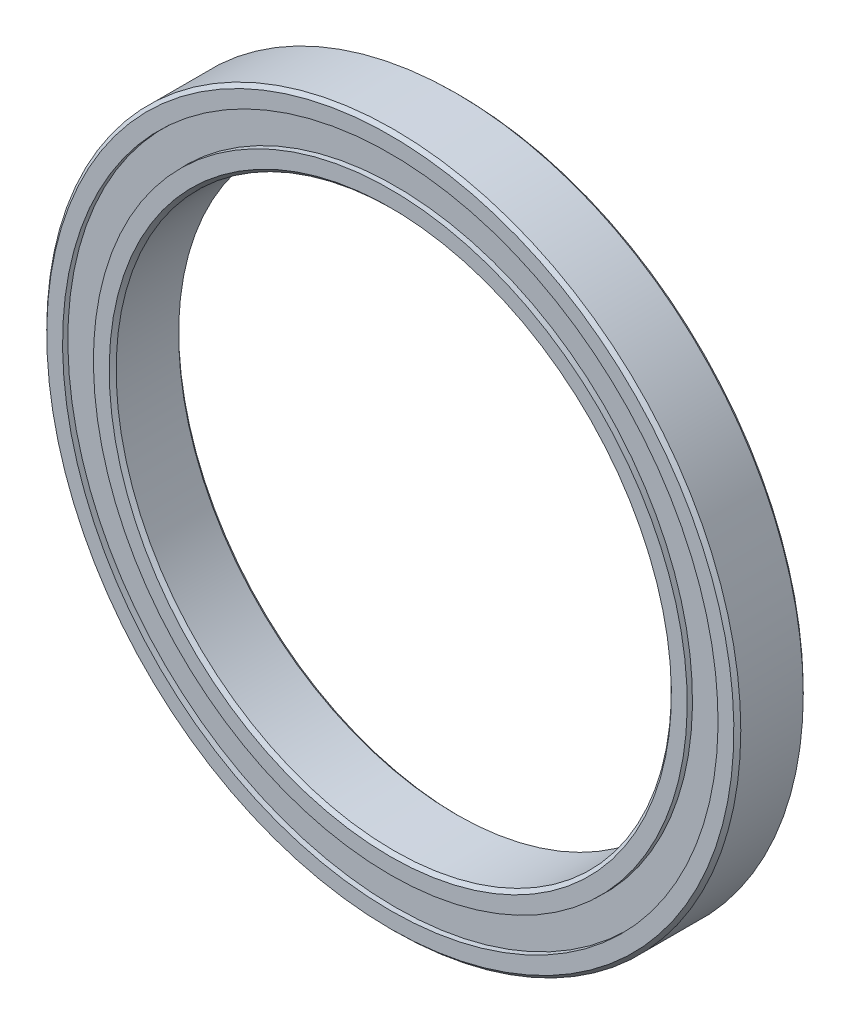
from build123d import *

# Parameters (mm, degrees)
SKETCH5_W         = 0.381
SKETCH5_H         = 4.393644444
CIRPATTERN1_COUNT = 27


with BuildPart() as part:
    # Sketch5 → Revolve1 (revolve)
    with BuildSketch(Plane(origin=(0, 0, 0), x_dir=(0, 0, -1), z_dir=(1, 0, 0)), mode=Mode.PRIVATE) as revolve1_sk:
        with BuildLine():
            Line((4.5, 50), (-4.5, 50))
            Line((-4.5, 50), (-5, 49.5))
            Line((-5, 49.5), (-5, 47.222222222))
            Line((-5, 47.222222222), (-2.222222222, 47.222222222))
            ThreePointArc((-2.222222222, 47.222222222), (0, 48.142696805), (2.222222222, 47.222222222))
            Line((2.222222222, 47.222222222), (5, 47.222222222))
            Line((5, 47.222222222), (5, 49.5))
            Line((5, 49.5), (4.5, 50))
        make_face()
        with Locations((4.071348403, 45)):
            Rectangle(SKETCH5_W, SKETCH5_H)
        with Locations((-4.071348403, 45)):
            Rectangle(SKETCH5_W, SKETCH5_H)
    revolve(revolve1_sk.sketch.rotate(Axis((0, 0, 5), (0, 0, -1)), 180), axis=Axis((0, 0, 5), (0, 0, -1)))


with BuildPart() as body_2:
    # Sketch3 → Revolve3 (revolve)
    with BuildSketch(Plane(origin=(0, 0, 0), x_dir=(0, 0, -1), z_dir=(1, 0, 0)), mode=Mode.PRIVATE) as revolve3_sk:
        with BuildLine():
            Line((-5, 42.777777778), (-2.222222222, 42.777777778))
            ThreePointArc((-2.222222222, 42.777777778), (0, 41.857303195), (2.222222222, 42.777777778))
            Line((2.222222222, 42.777777778), (5, 42.777777778))
            Line((5, 42.777777778), (5, 40.5))
            Line((5, 40.5), (4.5, 40))
            Line((4.5, 40), (-4.5, 40))
            Line((-4.5, 40), (-5, 40.5))
            Line((-5, 40.5), (-5, 42.777777778))
        make_face()
    revolve(revolve3_sk.sketch.rotate(Axis((0, 0, 5), (0, 0, -1)), 180), axis=Axis((0, 0, 5), (0, 0, -1)))


with BuildPart() as body_3:
    # Sketch4 → Revolve4 (revolve)
    with BuildSketch(Plane(origin=(0, 0, 0), x_dir=(0, 0, -1), z_dir=(1, 0, 0))):
        with BuildLine():
            Line((-3.142696805, 45), (3.142696805, 45))
            ThreePointArc((3.142696805, 45), (0, 48.142696805), (-3.142696805, 45))
        make_face()
    revolve(axis=Axis((0, 45, 3.142696805), (0, 0, -1)))


with BuildPart() as cirpattern1_1:
    # CirPattern1: pattern copy
    add(body_3.part.rotate(Axis((0, 0, 0), (0, 0, 1)), 1 * 360 / CIRPATTERN1_COUNT))


with BuildPart() as cirpattern1_2:
    # CirPattern1: pattern copy
    add(body_3.part.rotate(Axis((0, 0, 0), (0, 0, 1)), 2 * 360 / CIRPATTERN1_COUNT))


with BuildPart() as cirpattern1_3:
    # CirPattern1: pattern copy
    add(body_3.part.rotate(Axis((0, 0, 0), (0, 0, 1)), 3 * 360 / CIRPATTERN1_COUNT))


with BuildPart() as cirpattern1_4:
    # CirPattern1: pattern copy
    add(body_3.part.rotate(Axis((0, 0, 0), (0, 0, 1)), 4 * 360 / CIRPATTERN1_COUNT))


with BuildPart() as cirpattern1_5:
    # CirPattern1: pattern copy
    add(body_3.part.rotate(Axis((0, 0, 0), (0, 0, 1)), 5 * 360 / CIRPATTERN1_COUNT))


with BuildPart() as cirpattern1_6:
    # CirPattern1: pattern copy
    add(body_3.part.rotate(Axis((0, 0, 0), (0, 0, 1)), 6 * 360 / CIRPATTERN1_COUNT))


with BuildPart() as cirpattern1_7:
    # CirPattern1: pattern copy
    add(body_3.part.rotate(Axis((0, 0, 0), (0, 0, 1)), 7 * 360 / CIRPATTERN1_COUNT))


with BuildPart() as cirpattern1_8:
    # CirPattern1: pattern copy
    add(body_3.part.rotate(Axis((0, 0, 0), (0, 0, 1)), 8 * 360 / CIRPATTERN1_COUNT))


with BuildPart() as cirpattern1_9:
    # CirPattern1: pattern copy
    add(body_3.part.rotate(Axis((0, 0, 0), (0, 0, 1)), 9 * 360 / CIRPATTERN1_COUNT))


with BuildPart() as cirpattern1_10:
    # CirPattern1: pattern copy
    add(body_3.part.rotate(Axis((0, 0, 0), (0, 0, 1)), 10 * 360 / CIRPATTERN1_COUNT))


with BuildPart() as cirpattern1_11:
    # CirPattern1: pattern copy
    add(body_3.part.rotate(Axis((0, 0, 0), (0, 0, 1)), 11 * 360 / CIRPATTERN1_COUNT))


with BuildPart() as cirpattern1_12:
    # CirPattern1: pattern copy
    add(body_3.part.rotate(Axis((0, 0, 0), (0, 0, 1)), 12 * 360 / CIRPATTERN1_COUNT))


with BuildPart() as cirpattern1_13:
    # CirPattern1: pattern copy
    add(body_3.part.rotate(Axis((0, 0, 0), (0, 0, 1)), 13 * 360 / CIRPATTERN1_COUNT))


with BuildPart() as cirpattern1_14:
    # CirPattern1: pattern copy
    add(body_3.part.rotate(Axis((0, 0, 0), (0, 0, 1)), 14 * 360 / CIRPATTERN1_COUNT))


with BuildPart() as cirpattern1_15:
    # CirPattern1: pattern copy
    add(body_3.part.rotate(Axis((0, 0, 0), (0, 0, 1)), 15 * 360 / CIRPATTERN1_COUNT))


with BuildPart() as cirpattern1_16:
    # CirPattern1: pattern copy
    add(body_3.part.rotate(Axis((0, 0, 0), (0, 0, 1)), 16 * 360 / CIRPATTERN1_COUNT))


with BuildPart() as cirpattern1_17:
    # CirPattern1: pattern copy
    add(body_3.part.rotate(Axis((0, 0, 0), (0, 0, 1)), 17 * 360 / CIRPATTERN1_COUNT))


with BuildPart() as cirpattern1_18:
    # CirPattern1: pattern copy
    add(body_3.part.rotate(Axis((0, 0, 0), (0, 0, 1)), 18 * 360 / CIRPATTERN1_COUNT))


with BuildPart() as cirpattern1_19:
    # CirPattern1: pattern copy
    add(body_3.part.rotate(Axis((0, 0, 0), (0, 0, 1)), 19 * 360 / CIRPATTERN1_COUNT))


with BuildPart() as cirpattern1_20:
    # CirPattern1: pattern copy
    add(body_3.part.rotate(Axis((0, 0, 0), (0, 0, 1)), 20 * 360 / CIRPATTERN1_COUNT))


with BuildPart() as cirpattern1_21:
    # CirPattern1: pattern copy
    add(body_3.part.rotate(Axis((0, 0, 0), (0, 0, 1)), 21 * 360 / CIRPATTERN1_COUNT))


with BuildPart() as cirpattern1_22:
    # CirPattern1: pattern copy
    add(body_3.part.rotate(Axis((0, 0, 0), (0, 0, 1)), 22 * 360 / CIRPATTERN1_COUNT))


with BuildPart() as cirpattern1_23:
    # CirPattern1: pattern copy
    add(body_3.part.rotate(Axis((0, 0, 0), (0, 0, 1)), 23 * 360 / CIRPATTERN1_COUNT))


with BuildPart() as cirpattern1_24:
    # CirPattern1: pattern copy
    add(body_3.part.rotate(Axis((0, 0, 0), (0, 0, 1)), 24 * 360 / CIRPATTERN1_COUNT))


with BuildPart() as cirpattern1_25:
    # CirPattern1: pattern copy
    add(body_3.part.rotate(Axis((0, 0, 0), (0, 0, 1)), 25 * 360 / CIRPATTERN1_COUNT))


with BuildPart() as cirpattern1_26:
    # CirPattern1: pattern copy
    add(body_3.part.rotate(Axis((0, 0, 0), (0, 0, 1)), 26 * 360 / CIRPATTERN1_COUNT))


solid = Compound([part.part, body_2.part, body_3.part, cirpattern1_1.part, cirpattern1_2.part, cirpattern1_3.part, cirpattern1_4.part, cirpattern1_5.part, cirpattern1_6.part, cirpattern1_7.part, cirpattern1_8.part, cirpattern1_9.part, cirpattern1_10.part, cirpattern1_11.part, cirpattern1_12.part, cirpattern1_13.part, cirpattern1_14.part, cirpattern1_15.part, cirpattern1_16.part, cirpattern1_17.part, cirpattern1_18.part, cirpattern1_19.part, cirpattern1_20.part, cirpattern1_21.part, cirpattern1_22.part, cirpattern1_23.part, cirpattern1_24.part, cirpattern1_25.part, cirpattern1_26.part])
